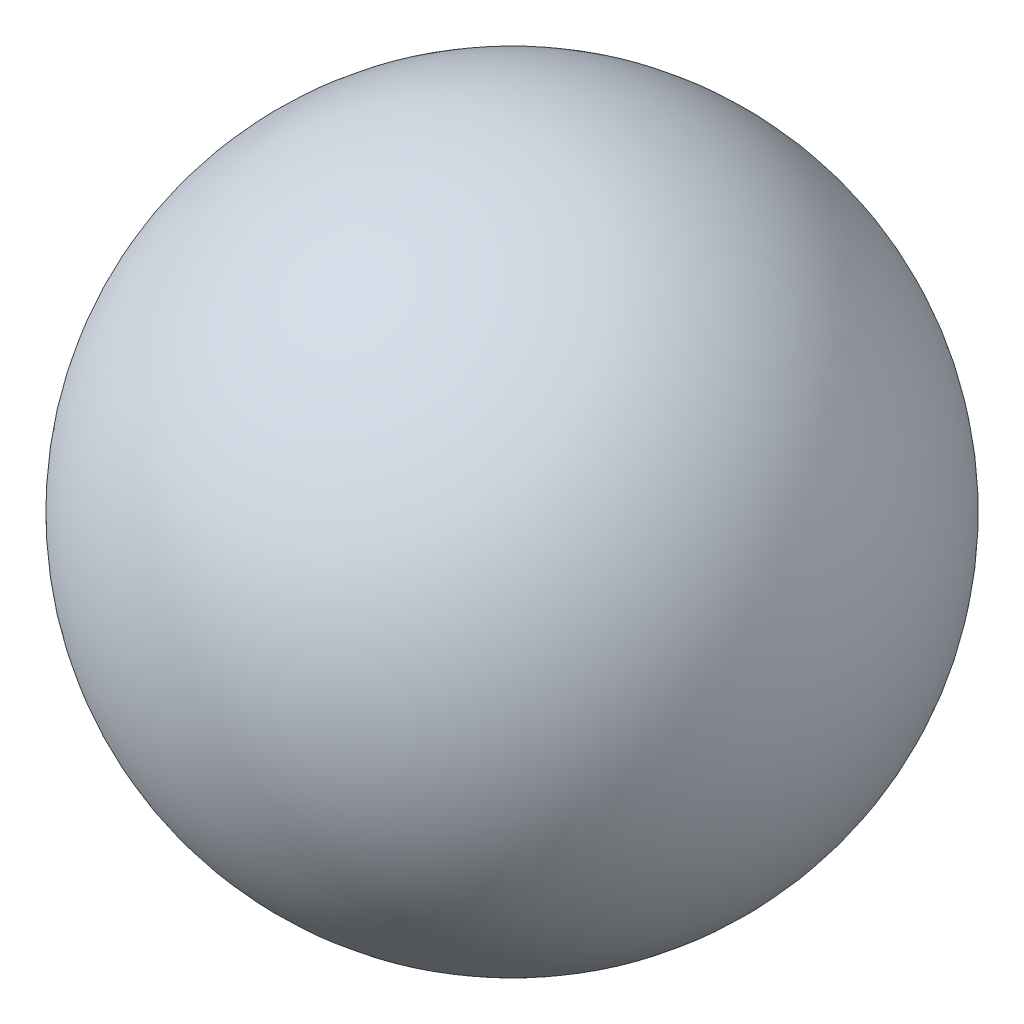
from build123d import *


with BuildPart() as part:
    # Sketch1 → Revolve1 (revolve)
    with BuildSketch(Plane.XY):
        with BuildLine():
            Line((0, 16), (0, -16))
            ThreePointArc((0, -16), (-16, 0), (0, 16))
        make_face()
    revolve(axis=Axis((0, 39.890116134, 0), (0, -1, 0)))

    # Sketch2 → Cut-Revolve1 (revolve, cut)
    with BuildSketch(Plane.XY):
        with BuildLine():
            Line((0, 15), (0, -15))
            ThreePointArc((0, -15), (-15, 0), (0, 15))
        make_face()
    revolve(axis=Axis((0, 39.890116134, 0), (0, -1, 0)), mode=Mode.SUBTRACT)


solid = part.part
